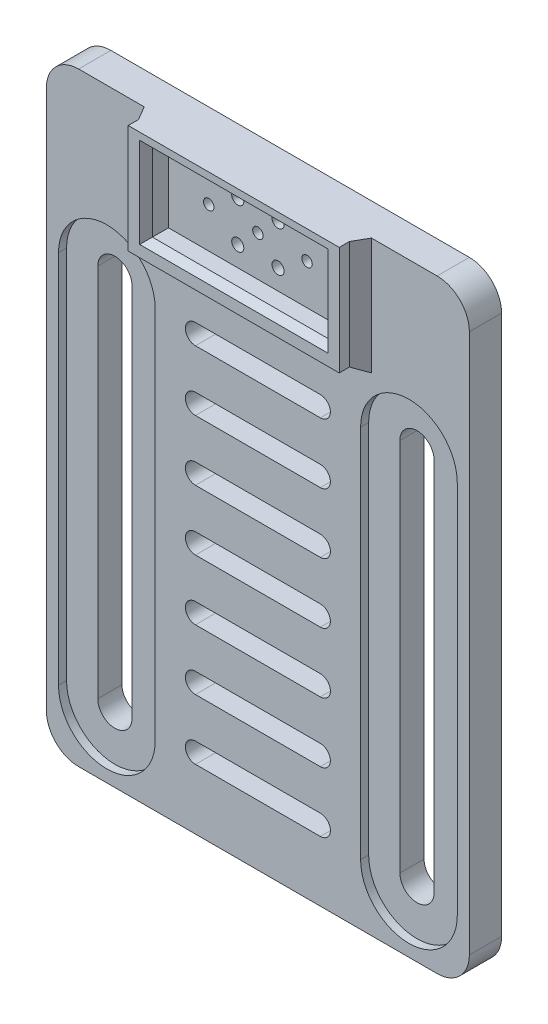
from build123d import *
from OCP.BRepFilletAPI import BRepFilletAPI_MakeChamfer

# Parameters (mm, degrees)
CROQUIS1_W              = 105
CROQUIS1_H              = 150
SALIENTE_EXTRUIR1_DEPTH = 8
CROQUIS2_R              = 1.3
CROQUIS2_R_2            = 1.5
CORTAR_EXTRUIR4_DEPTH   = 8
CROQUIS3_W              = 52.4
CROQUIS3_H              = 27
SALIENTE_EXTRUIR2_DEPTH = 6
REDONDEO1_R             = 8
REDONDEO2_R             = 8
REDONDEO3_R             = 8
REDONDEO4_R             = 8
CORTAR_EXTRUIR5_DEPTH   = 2
CHAFL_N1_SIZE           = 2
CHAFL_N1_SIZE2          = 1.154700538
CHAFL_N2_SIZE           = 2
CHAFL_N2_SIZE2          = 3.464101615
CORTAR_EXTRUIR6_DEPTH   = 8
CORTAR_EXTRUIR7_DEPTH   = 2.45
CHAFL_N3_SIZE           = 0.5
CHAFL_N3_SIZE2          = 0.866025404
CROQUIS9_R              = 1.3
CORTAR_EXTRUIR9_DEPTH   = 8


with BuildPart() as part:
    # Croquis1 → Saliente-Extruir1 (new body)
    with BuildSketch(Plane.XY):
        with Locations((52.5, 75)):
            Rectangle(CROQUIS1_W, CROQUIS1_H)
    extrude(amount=SALIENTE_EXTRUIR1_DEPTH)

    # Croquis2 → Cortar-Extruir4 (cut)
    with BuildSketch(Plane.XY.offset(8)):
        with Locations((52.5, 137)):
            Circle(CROQUIS2_R)
        with Locations((47.5, 142)):
            Circle(CROQUIS2_R_2)
        with Locations((47.5, 132)):
            Circle(CROQUIS2_R_2)
        with Locations(Location((57.5, 132, 0), (0, 0, 180))):
            Circle(CROQUIS2_R_2)
        with Locations(Location((57.5, 142, 0), (0, 0, 180))):
            Circle(CROQUIS2_R_2)
        with BuildLine():
            Line((19.25, 108), (19.25, 15))
            ThreePointArc((19.25, 15), (15, 10.75), (10.75, 15))
            Line((10.75, 15), (10.75, 108))
            ThreePointArc((10.75, 108), (15, 112.25), (19.25, 108))
        make_face()
        with BuildLine():
            Line((85.75, 108), (85.75, 15))
            ThreePointArc((85.75, 15), (90, 10.75), (94.25, 15))
            Line((94.25, 15), (94.25, 108))
            ThreePointArc((94.25, 108), (90, 112.25), (85.75, 108))
        make_face()
    extrude(amount=-CORTAR_EXTRUIR4_DEPTH, mode=Mode.SUBTRACT)

    # Croquis3 → Saliente-Extruir2 (add)
    with BuildSketch(Plane.XY.offset(8)):
        with Locations((52.5, 136.5)):
            Rectangle(CROQUIS3_W, CROQUIS3_H)
        Polygon((74.7, 127), (52.5, 127), (30.3, 127), (30.3, 147.1), (74.7, 147.1), align=None, mode=Mode.SUBTRACT)
    extrude(amount=SALIENTE_EXTRUIR2_DEPTH)

    # Redondeo1
    redondeo1_edges = [part.edges().sort_by_distance(p)[0] for p in [
        (0, 150, 4),
    ]]
    fillet(redondeo1_edges, radius=REDONDEO1_R)

    # Redondeo2
    redondeo2_edges = [part.edges().sort_by_distance(p)[0] for p in [
        (105, 150, 4),
    ]]
    fillet(redondeo2_edges, radius=REDONDEO2_R)

    # Redondeo3
    redondeo3_edges = [part.edges().sort_by_distance(p)[0] for p in [
        (0, 0, 4),
    ]]
    fillet(redondeo3_edges, radius=REDONDEO3_R)

    # Redondeo4
    redondeo4_edges = [part.edges().sort_by_distance(p)[0] for p in [
        (105, 0, 4),
    ]]
    fillet(redondeo4_edges, radius=REDONDEO4_R)

    # Croquis4 → Cortar-Extruir5 (cut)
    # profile 1 of 2: a face of its own
    with BuildSketch(Plane.XY.offset(8)):
        with BuildLine():
            Line((27, 108), (27, 15))
            ThreePointArc((27, 15), (15, 3), (3, 15))
            Line((3, 15), (3, 108))
            ThreePointArc((3, 108), (15, 120), (27, 108))
        make_face()
        with BuildLine():
            Line((10.75, 108), (10.75, 15))
            ThreePointArc((10.75, 15), (15, 10.75), (19.25, 15))
            Line((19.25, 15), (19.25, 108))
            ThreePointArc((19.25, 108), (15, 112.25), (10.75, 108))
        make_face(mode=Mode.SUBTRACT)
    # profile 2 of 2: a face of its own
    with BuildSketch(Plane.XY.offset(8)):
        with BuildLine():
            Line((78, 108), (78, 15))
            ThreePointArc((78, 15), (90, 3), (102, 15))
            Line((102, 15), (102, 108))
            ThreePointArc((102, 108), (90, 120), (78, 108))
        make_face()
        with BuildLine():
            Line((85.75, 108), (85.75, 15))
            ThreePointArc((85.75, 15), (90, 10.75), (94.25, 15))
            Line((94.25, 15), (94.25, 108))
            ThreePointArc((94.25, 108), (90, 112.25), (85.75, 108))
        make_face(mode=Mode.SUBTRACT)
    extrude(amount=-CORTAR_EXTRUIR5_DEPTH, mode=Mode.SUBTRACT)

    # Chaflán1: one chamfer whose edges measure the first distance from different faces: ONE call of the kernel's chamfer builder (chamfer() names one face for all edges)
    chafl_n1_edges_1 = [part.edges().sort_by_distance(p)[0] for p in [
        (52.5, 127, 14),
    ]]
    chafl_n1_side_1 = [part.faces().sort_by_distance(p)[0] for p in [
        (52.5, 127, 11),
    ]]
    chafl_n1_edges_2 = [part.edges().sort_by_distance(p)[0] for p in [
        (30.3, 137.05, 14),
    ]]
    chafl_n1_side_2 = [part.faces().sort_by_distance(p)[0] for p in [
        (30.3, 137.05, 11),
    ]]
    chafl_n1_edges_3 = [part.edges().sort_by_distance(p)[0] for p in [
        (52.5, 147.1, 14),
    ]]
    chafl_n1_side_3 = [part.faces().sort_by_distance(p)[0] for p in [
        (52.5, 147.1, 11),
    ]]
    chafl_n1_edges_4 = [part.edges().sort_by_distance(p)[0] for p in [
        (74.7, 137.05, 14),
    ]]
    chafl_n1_side_4 = [part.faces().sort_by_distance(p)[0] for p in [
        (74.7, 137.05, 11),
    ]]
    chafl_n1 = BRepFilletAPI_MakeChamfer(part.part.solid().wrapped)
    for e in chafl_n1_edges_1:
        chafl_n1.Add(CHAFL_N1_SIZE, CHAFL_N1_SIZE2, e.wrapped, chafl_n1_side_1[0].wrapped)  # the first distance lies on this face
    for e in chafl_n1_edges_2:
        chafl_n1.Add(CHAFL_N1_SIZE, CHAFL_N1_SIZE2, e.wrapped, chafl_n1_side_2[0].wrapped)  # the first distance lies on this face
    for e in chafl_n1_edges_3:
        chafl_n1.Add(CHAFL_N1_SIZE, CHAFL_N1_SIZE2, e.wrapped, chafl_n1_side_3[0].wrapped)  # the first distance lies on this face
    for e in chafl_n1_edges_4:
        chafl_n1.Add(CHAFL_N1_SIZE, CHAFL_N1_SIZE2, e.wrapped, chafl_n1_side_4[0].wrapped)  # the first distance lies on this face
    add(Compound.cast(chafl_n1.Shape()), mode=Mode.REPLACE)

    # Chaflán2
    chafl_n2_edges = [part.edges().sort_by_distance(p)[0] for p in [
        (52.5, 123, 8),
        (78.7, 136.5, 8),
        (26.3, 136.5, 8),
    ]]
    chafl_n2_side = [part.faces().sort_by_distance(p)[0] for p in [
        (52.5, 73.36933007, 8),
    ]]
    chamfer(chafl_n2_edges, length=CHAFL_N2_SIZE, length2=CHAFL_N2_SIZE2, reference=chafl_n2_side[0])

    # Croquis6 → Cortar-Extruir6 (cut)
    with BuildSketch(Plane.XY.offset(8)):
        with BuildLine():
            Line((37, 20), (68, 20))
            ThreePointArc((68, 20), (70.5, 17.5), (68, 15))
            Line((68, 15), (37, 15))
            ThreePointArc((37, 15), (34.5, 17.5), (37, 20))
        make_face()
        with BuildLine():
            Line((37, 30), (68, 30))
            ThreePointArc((68, 30), (70.5, 32.5), (68, 35))
            Line((68, 35), (37, 35))
            ThreePointArc((37, 35), (34.5, 32.5), (37, 30))
        make_face()
        with BuildLine():
            Line((37, 45), (68, 45))
            ThreePointArc((68, 45), (70.5, 47.5), (68, 50))
            Line((68, 50), (37, 50))
            ThreePointArc((37, 50), (34.5, 47.5), (37, 45))
        make_face()
        with BuildLine():
            Line((37, 60), (68, 60))
            ThreePointArc((68, 60), (70.5, 62.5), (68, 65))
            Line((68, 65), (37, 65))
            ThreePointArc((37, 65), (34.5, 62.5), (37, 60))
        make_face()
        with BuildLine():
            Line((37, 75), (68, 75))
            ThreePointArc((68, 75), (70.5, 77.5), (68, 80))
            Line((68, 80), (37, 80))
            ThreePointArc((37, 80), (34.5, 77.5), (37, 75))
        make_face()
        with BuildLine():
            Line((37, 90), (68, 90))
            ThreePointArc((68, 90), (70.5, 92.5), (68, 95))
            Line((68, 95), (37, 95))
            ThreePointArc((37, 95), (34.5, 92.5), (37, 90))
        make_face()
        with BuildLine():
            Line((37, 105), (68, 105))
            ThreePointArc((68, 105), (70.5, 107.5), (68, 110))
            Line((68, 110), (37, 110))
            ThreePointArc((37, 110), (34.5, 107.5), (37, 105))
        make_face()
    extrude(amount=-CORTAR_EXTRUIR6_DEPTH, mode=Mode.SUBTRACT)

    # Croquis8 → Cortar-Extruir7 (cut)
    with BuildSketch(Plane(origin=(0, 0, 0), x_dir=(-1, 0, 0), z_dir=(0, 0, -1))):
        Polygon((-52.5, 140.175426481), (-55.25, 138.58771324), (-55.25, 135.41228676), (-52.5, 133.824573519), (-49.75, 135.41228676), (-49.75, 138.58771324), align=None)
        Polygon((-64.7, 140.202903958), (-67.45, 138.615190718), (-67.45, 135.439764237), (-64.7, 133.852050997), (-61.95, 135.439764237), (-61.95, 138.615190718), align=None)
        Polygon((-37.55, 138.615190718), (-40.3, 140.202903958), (-43.05, 138.615190718), (-43.05, 135.439764237), (-40.3, 133.852050997), (-37.55, 135.439764237), align=None)
    extrude(amount=-CORTAR_EXTRUIR7_DEPTH, mode=Mode.SUBTRACT)

    # Chaflán3
    chafl_n3_edges = [part.edges().sort_by_distance(p)[0] for p in [
        (66.075, 134.645907617, 0),
        (63.325, 134.645907617, 0),
        (61.95, 137.027477477, 0),
        (63.325, 139.409047338, 0),
        (66.075, 139.409047338, 0),
        (67.45, 137.027477477, 0),
        (41.675, 139.409047338, 0),
        (43.05, 137.027477477, 0),
        (41.675, 134.645907617, 0),
        (38.925, 134.645907617, 0),
        (37.55, 137.027477477, 0),
        (38.925, 139.409047338, 0),
        (49.75, 137, 0),
        (51.125, 139.38156986, 0),
        (53.875, 139.38156986, 0),
        (55.25, 137, 0),
        (53.875, 134.61843014, 0),
        (51.125, 134.61843014, 0),
    ]]
    chafl_n3_side = [part.faces().sort_by_distance(p)[0] for p in [
        (52.5, 1.830983342, 0),
    ]]
    chamfer(chafl_n3_edges, length=CHAFL_N3_SIZE, length2=CHAFL_N3_SIZE2, reference=chafl_n3_side[0])

    # Croquis9 → Cortar-Extruir9 (cut)
    with BuildSketch(Plane(origin=(0, 0, 0), x_dir=(-1, 0, 0), z_dir=(0, 0, -1))):
        with Locations((-64.7, 137.027477477)):
            Circle(CROQUIS9_R)
        with Locations((-40.3, 137.027477477)):
            Circle(CROQUIS9_R)
    extrude(amount=-CORTAR_EXTRUIR9_DEPTH, mode=Mode.SUBTRACT)


solid = part.part
